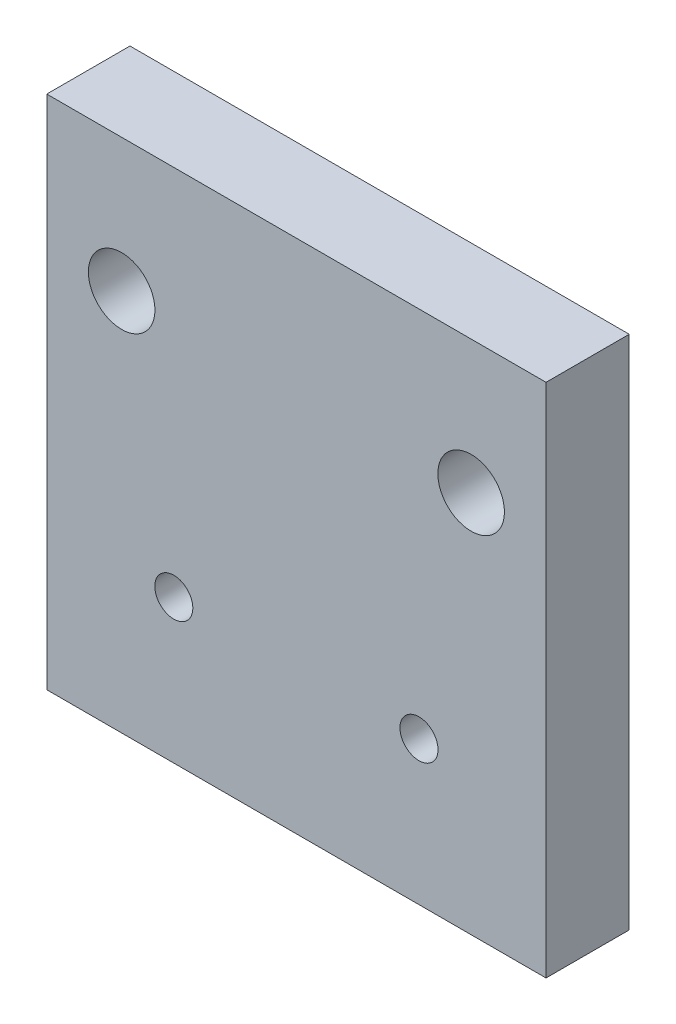
from build123d import *

# Parameters (mm, degrees)
SKETCH1_W           = 30
SKETCH1_H           = 31
BOSS_EXTRUDE1_DEPTH = 5
SKETCH2_R           = 1.143
SKETCH2_R_2         = 2
CUT_EXTRUDE1_DEPTH  = 10


with BuildPart() as part:
    # Sketch1 → Boss-Extrude1 (new body)
    with BuildSketch(Plane.XY):
        Rectangle(SKETCH1_W, SKETCH1_H)
    extrude(amount=BOSS_EXTRUDE1_DEPTH)

    # Sketch2 → Cut-Extrude1 (cut)
    with BuildSketch(Plane.XY.offset(5)):
        with Locations((-7.366, -6.866)):
            Circle(SKETCH2_R)
        with Locations((7.366, -6.866)):
            Circle(SKETCH2_R)
        with Locations((-10.5, 7.5)):
            Circle(SKETCH2_R_2)
        with Locations((10.5, 7.5)):
            Circle(SKETCH2_R_2)
    extrude(amount=-CUT_EXTRUDE1_DEPTH, mode=Mode.SUBTRACT)


solid = part.part
